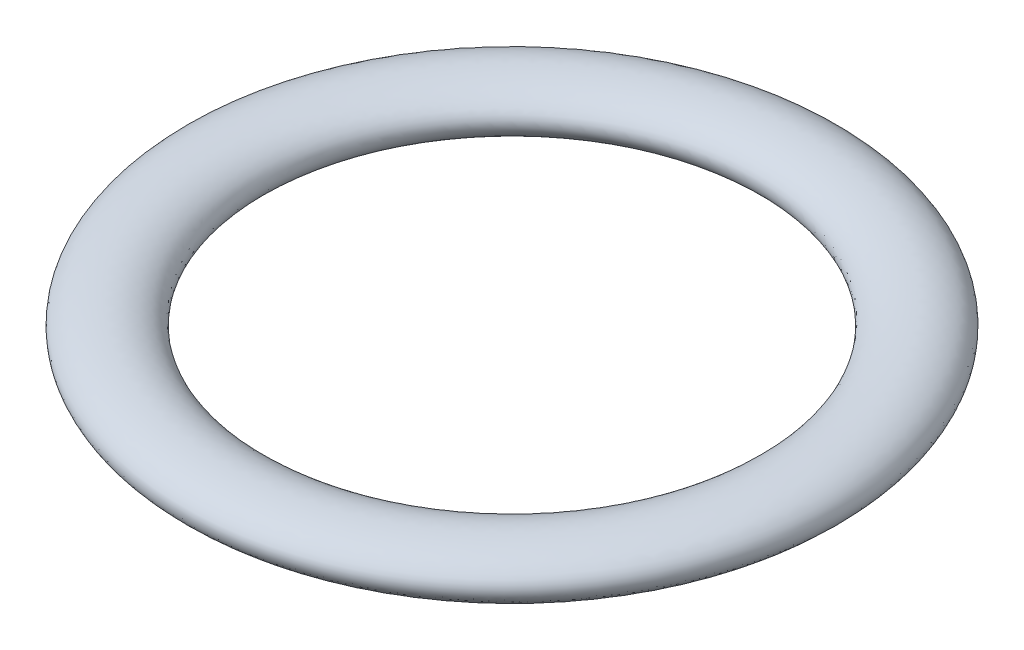
from build123d import *

# Parameters (mm, degrees)
RECONSTRUCTED_NOMINAL_AXIAL_PROFILE_RX = 1.311736063
RECONSTRUCTED_NOMINAL_AXIAL_PROFILE_RY = 0.725


with BuildPart() as part:
    # Reconstructed nominal axial profile → Native revolved geometry (revolve)
    with BuildSketch(Plane.XY):
        with Locations((8.675, 0)):
            Ellipse(RECONSTRUCTED_NOMINAL_AXIAL_PROFILE_RX, RECONSTRUCTED_NOMINAL_AXIAL_PROFILE_RY)
    revolve(axis=Axis((0, -500, 0), (0, 1, 0)))


solid = part.part
